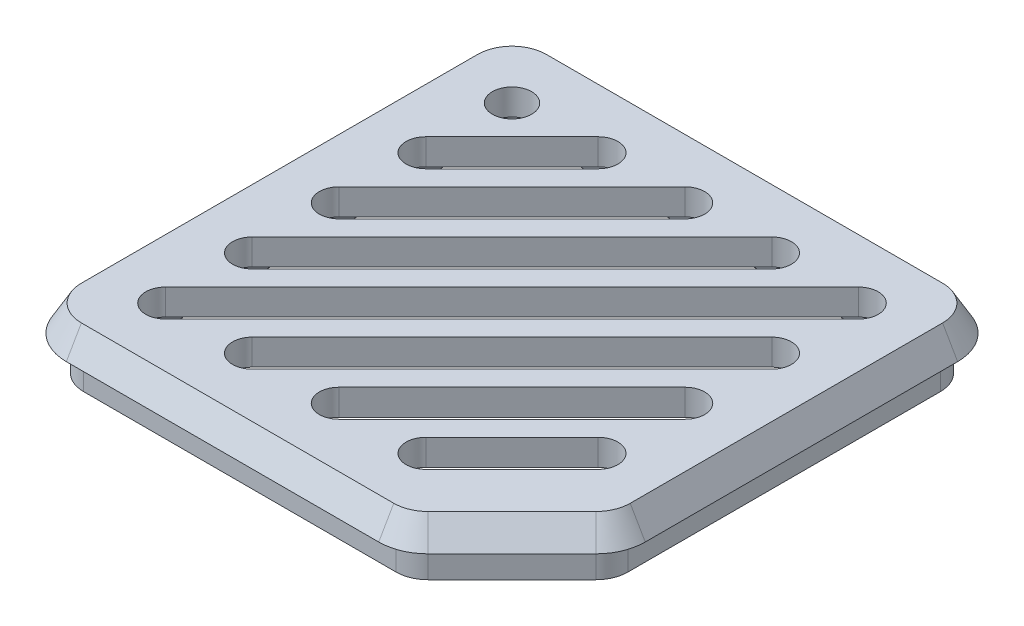
from build123d import *

# Parameters (mm, degrees)
EXTRUDE_1_DEPTH     = 2
EXTRUDE_2_DEPTH     = 1.5
EXTRUDE_2_TAPER     = 30
CUT_EXTRUDE_1_REACH = 95.039
SKETCH_3_R          = 1.131038805


with BuildPart() as part:
    # 草图1 → 凸台-拉伸1 (new body)
    with BuildSketch(Plane(origin=(0, 0, 0), x_dir=(1, 0, 0), z_dir=(0, 1, 0))):
        with BuildLine():
            Line((-65.314374304, 18.3), (-88.142801429, 18.3))
            ThreePointArc((-88.142801429, 18.3), (-89.450948974, 17.758147545), (-89.992801429, 16.45))
            Line((-89.992801429, 16.45), (-89.992801429, -6.378427125))
            ThreePointArc((-89.992801429, -6.378427125), (-89.450948974, -7.68657467), (-88.142801429, -8.228427125))
            Line((-88.142801429, -8.228427125), (-70.142801429, -8.228427125))
            ThreePointArc((-70.142801429, -8.228427125), (-69.434837079, -8.08760426), (-68.834653884, -7.68657467))
            Line((-68.834653884, -7.68657467), (-64.006226759, -2.858147545))
            ThreePointArc((-64.006226759, -2.858147545), (-63.605197169, -2.25796435), (-63.464374304, -1.55))
            Line((-63.464374304, -1.55), (-63.464374304, 16.45))
            ThreePointArc((-63.464374304, 16.45), (-64.006226759, 17.758147545), (-65.314374304, 18.3))
        make_face()
        with BuildLine():
            Line((-65.314374304, 17.3), (-88.142801429, 17.3))
            ThreePointArc((-88.142801429, 17.3), (-88.743842193, 17.051040764), (-88.992801429, 16.45))
            Line((-88.992801429, 16.45), (-88.992801429, -6.378427125))
            ThreePointArc((-88.992801429, -6.378427125), (-88.743842193, -6.979467889), (-88.142801429, -7.228427125))
            Line((-88.142801429, -7.228427125), (-70.142801429, -7.228427125))
            ThreePointArc((-70.142801429, -7.228427125), (-69.817520511, -7.163724728), (-69.541760665, -6.979467889))
            Line((-69.541760665, -6.979467889), (-64.71333354, -2.151040764))
            ThreePointArc((-64.71333354, -2.151040764), (-64.529076702, -1.875280918), (-64.464374304, -1.55))
            Line((-64.464374304, -1.55), (-64.464374304, 16.45))
            ThreePointArc((-64.464374304, 16.45), (-64.71333354, 17.051040764), (-65.314374304, 17.3))
        make_face(mode=Mode.SUBTRACT)
    extrude(amount=-EXTRUDE_1_DEPTH)

    # 草图2 → 凸台-拉伸2 (add)
    with BuildSketch(Plane(origin=(0, 0, 0), x_dir=(1, 0, 0), z_dir=(0, 1, 0))):
        with BuildLine():
            Line((-65.314374304, 19.3), (-88.142801429, 19.3))
            ThreePointArc((-88.142801429, 19.3), (-90.158055755, 18.465254326), (-90.992801429, 16.45))
            Line((-90.992801429, 16.45), (-90.992801429, -6.378427125))
            ThreePointArc((-90.992801429, -6.378427125), (-90.158055755, -8.393681451), (-88.142801429, -9.228427125))
            Line((-88.142801429, -9.228427125), (-70.142801429, -9.228427125))
            ThreePointArc((-70.142801429, -9.228427125), (-69.052153647, -9.011483793), (-68.127547103, -8.393681451))
            Line((-68.127547103, -8.393681451), (-63.299119978, -3.565254327))
            ThreePointArc((-63.299119978, -3.565254327), (-62.681317637, -2.640647782), (-62.464374304, -1.55))
            Line((-62.464374304, -1.55), (-62.464374304, 16.45))
            ThreePointArc((-62.464374304, 16.45), (-63.299119978, 18.465254326), (-65.314374304, 19.3))
        make_face()
    extrude(amount=EXTRUDE_2_DEPTH, taper=EXTRUDE_2_TAPER)

    # 草图3 → 切除-拉伸1 (cut, up to next)
    with BuildSketch(Plane.XZ, mode=Mode.PRIVATE) as cut_extrude_1_sk1:
        with Locations(Location((-86.712801429, -15.02, 0), (0, 0, 270))):
            Circle(SKETCH_3_R)
    cut_extrude_1_tool1 = extrude(cut_extrude_1_sk1.sketch, amount=-CUT_EXTRUDE_1_REACH, mode=Mode.PRIVATE) & part.part
    # 草图3 → 切除-拉伸1 (cut, up to next)
    with BuildSketch(Plane.XZ, mode=Mode.PRIVATE) as cut_extrude_1_sk2:
        with BuildLine():
            Line((-85.91303622, -9.251807666), (-80.944609096, -14.220234791))
            ThreePointArc((-80.944609096, -14.220234791), (-80.944609096, -15.819765208), (-82.544139513, -15.819765208))
            Line((-82.544139513, -15.819765208), (-87.512566638, -10.851338084))
            ThreePointArc((-87.512566638, -10.851338084), (-87.512566638, -9.251807666), (-85.91303622, -9.251807666))
        make_face()
    cut_extrude_1_tool2 = extrude(cut_extrude_1_sk2.sketch, amount=-CUT_EXTRUDE_1_REACH, mode=Mode.PRIVATE) & part.part
    # 草图3 → 切除-拉伸1 (cut, up to next)
    with BuildSketch(Plane.XZ, mode=Mode.PRIVATE) as cut_extrude_1_sk3:
        with BuildLine():
            Line((-70.91303622, 5.748192334), (-65.944609096, 0.779765209))
            ThreePointArc((-65.944609096, 0.779765209), (-65.944609096, -0.819765208), (-67.544139513, -0.819765208))
            Line((-67.544139513, -0.819765208), (-72.512566638, 4.148661916))
            ThreePointArc((-72.512566638, 4.148661916), (-72.512566638, 5.748192334), (-70.91303622, 5.748192334))
        make_face()
    cut_extrude_1_tool3 = extrude(cut_extrude_1_sk3.sketch, amount=-CUT_EXTRUDE_1_REACH, mode=Mode.PRIVATE) & part.part
    # 草图3 → 切除-拉伸1 (cut, up to next)
    with BuildSketch(Plane.XZ, mode=Mode.PRIVATE) as cut_extrude_1_sk4:
        with BuildLine():
            Line((-75.91303622, 5.748192334), (-65.944609096, -4.220234791))
            ThreePointArc((-65.944609096, -4.220234791), (-65.944609096, -5.819765208), (-67.544139513, -5.819765208))
            Line((-67.544139513, -5.819765208), (-77.512566638, 4.148661916))
            ThreePointArc((-77.512566638, 4.148661916), (-77.512566638, 5.748192334), (-75.91303622, 5.748192334))
        make_face()
    cut_extrude_1_tool4 = extrude(cut_extrude_1_sk4.sketch, amount=-CUT_EXTRUDE_1_REACH, mode=Mode.PRIVATE) & part.part
    # 草图3 → 切除-拉伸1 (cut, up to next)
    with BuildSketch(Plane.XZ, mode=Mode.PRIVATE) as cut_extrude_1_sk5:
        with BuildLine():
            Line((-80.91303622, 5.748192334), (-65.944609096, -9.220234791))
            ThreePointArc((-65.944609096, -9.220234791), (-65.944609096, -10.819765208), (-67.544139513, -10.819765208))
            Line((-67.544139513, -10.819765208), (-82.512566638, 4.148661916))
            ThreePointArc((-82.512566638, 4.148661916), (-82.512566638, 5.748192334), (-80.91303622, 5.748192334))
        make_face()
    cut_extrude_1_tool5 = extrude(cut_extrude_1_sk5.sketch, amount=-CUT_EXTRUDE_1_REACH, mode=Mode.PRIVATE) & part.part
    # 草图3 → 切除-拉伸1 (cut, up to next)
    with BuildSketch(Plane.XZ, mode=Mode.PRIVATE) as cut_extrude_1_sk6:
        with BuildLine():
            Line((-85.91303622, 0.748192334), (-70.944609096, -14.220234791))
            ThreePointArc((-70.944609096, -14.220234791), (-70.944609096, -15.819765208), (-72.544139513, -15.819765208))
            Line((-72.544139513, -15.819765208), (-87.512566638, -0.851338084))
            ThreePointArc((-87.512566638, -0.851338084), (-87.512566638, 0.748192334), (-85.91303622, 0.748192334))
        make_face()
    cut_extrude_1_tool6 = extrude(cut_extrude_1_sk6.sketch, amount=-CUT_EXTRUDE_1_REACH, mode=Mode.PRIVATE) & part.part
    # 草图3 → 切除-拉伸1 (cut, up to next)
    with BuildSketch(Plane.XZ, mode=Mode.PRIVATE) as cut_extrude_1_sk7:
        with BuildLine():
            Line((-85.91303622, 5.748192334), (-65.944609096, -14.220234791))
            ThreePointArc((-65.944609096, -14.220234791), (-65.944609096, -15.819765208), (-67.544139513, -15.819765208))
            Line((-67.544139513, -15.819765208), (-87.512566638, 4.148661916))
            ThreePointArc((-87.512566638, 4.148661916), (-87.512566638, 5.748192334), (-85.91303622, 5.748192334))
        make_face()
    cut_extrude_1_tool7 = extrude(cut_extrude_1_sk7.sketch, amount=-CUT_EXTRUDE_1_REACH, mode=Mode.PRIVATE) & part.part
    # 草图3 → 切除-拉伸1 (cut, up to next)
    with BuildSketch(Plane.XZ, mode=Mode.PRIVATE) as cut_extrude_1_sk8:
        with BuildLine():
            Line((-85.91303622, -4.251807666), (-75.944609096, -14.220234791))
            ThreePointArc((-75.944609096, -14.220234791), (-75.944609096, -15.819765208), (-77.544139513, -15.819765208))
            Line((-77.544139513, -15.819765208), (-87.512566638, -5.851338084))
            ThreePointArc((-87.512566638, -5.851338084), (-87.512566638, -4.251807666), (-85.91303622, -4.251807666))
        make_face()
    cut_extrude_1_tool8 = extrude(cut_extrude_1_sk8.sketch, amount=-CUT_EXTRUDE_1_REACH, mode=Mode.PRIVATE) & part.part
    add(cut_extrude_1_tool1.solids().sort_by_distance((-86.712801, 0, -15.02))[0], mode=Mode.SUBTRACT)
    add(cut_extrude_1_tool2.solids().sort_by_distance((-84.228588, 0, -12.535786))[0], mode=Mode.SUBTRACT)
    add(cut_extrude_1_tool3.solids().sort_by_distance((-69.228588, 0, 2.464214))[0], mode=Mode.SUBTRACT)
    add(cut_extrude_1_tool4.solids().sort_by_distance((-71.728588, 0, -0.035786))[0], mode=Mode.SUBTRACT)
    add(cut_extrude_1_tool5.solids().sort_by_distance((-74.228588, 0, -2.535786))[0], mode=Mode.SUBTRACT)
    add(cut_extrude_1_tool6.solids().sort_by_distance((-79.228588, 0, -7.535786))[0], mode=Mode.SUBTRACT)
    add(cut_extrude_1_tool7.solids().sort_by_distance((-76.728588, 0, -5.035786))[0], mode=Mode.SUBTRACT)
    add(cut_extrude_1_tool8.solids().sort_by_distance((-81.728588, 0, -10.035786))[0], mode=Mode.SUBTRACT)


solid = part.part
